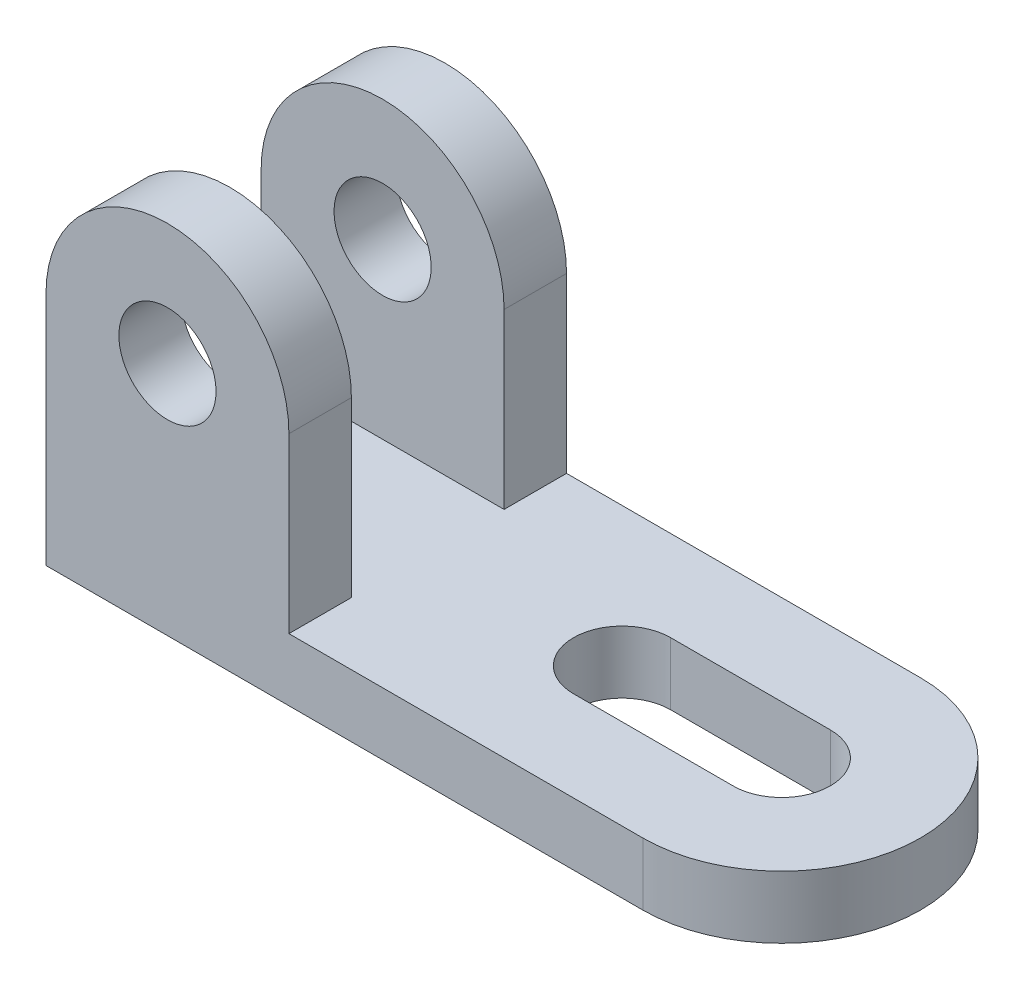
from build123d import *

# Parameters (mm, degrees)
BOSS_EXTRUDE1_DEPTH = 9
SKETCH2_3_W         = 35
SKETCH2_3_H         = 9
BOSS_EXTRUDE2_DEPTH = 55.5
SKETCH3_R           = 7
CUT_EXTRUDE1_DEPTH  = 55.5


with BuildPart() as part:
    # Sketch2 → Boss-Extrude1 (new body)
    with BuildSketch(Plane(origin=(0, 0, 0), x_dir=(1, 0, 0), z_dir=(0, 1, 0))):
        with BuildLine():
            Line((-12.051133951, 20), (-63.051133951, 20))
            Line((-63.051133951, 20), (-63.051133951, 11))
            Line((-63.051133951, 11), (-98.051133951, 11))
            Line((-98.051133951, 11), (-98.051133951, -11))
            Line((-98.051133951, -11), (-63.051133951, -11))
            Line((-63.051133951, -11), (-63.051133951, -20))
            Line((-63.051133951, -20), (-12.051133951, -20))
            ThreePointArc((-12.051133951, -20), (7.948866049, 0), (-12.051133951, 20))
        make_face()
        with BuildLine():
            ThreePointArc((-12.051133951, 7), (-5.051133951, 0), (-12.051133951, -7))
            Line((-12.051133951, -7), (-35.051133951, -7))
            ThreePointArc((-35.051133951, -7), (-42.051133951, 0), (-35.051133951, 7))
            Line((-35.051133951, 7), (-12.051133951, 7))
        make_face(mode=Mode.SUBTRACT)
    extrude(amount=BOSS_EXTRUDE1_DEPTH)

    # Sketch2<3> → Boss-Extrude2 (add)
    with BuildSketch(Plane(origin=(0, 0, 0), x_dir=(1, 0, 0), z_dir=(0, 1, 0))):
        with Locations((-80.551133951, 15.5)):
            Rectangle(SKETCH2_3_W, SKETCH2_3_H)
        with Locations((-80.551133951, -15.5)):
            Rectangle(SKETCH2_3_W, SKETCH2_3_H)
    extrude(amount=BOSS_EXTRUDE2_DEPTH)

    # Sketch3 → Cut-Extrude1 (cut)
    with BuildSketch(Plane.XY.offset(20)):
        with BuildLine():
            ThreePointArc((-98.051133951, 33.947689481), (-80.551133951, 51.447689481), (-63.051133951, 33.947689481))
            Line((-63.051133951, 33.947689481), (-63.051133951, 55.5))
            Line((-63.051133951, 55.5), (-98.051133951, 55.5))
            Line((-98.051133951, 55.5), (-98.051133951, 33.947689481))
        make_face()
        with Locations((-80.551133951, 33.947689481)):
            Circle(SKETCH3_R)
    extrude(amount=-CUT_EXTRUDE1_DEPTH, mode=Mode.SUBTRACT)


solid = part.part
